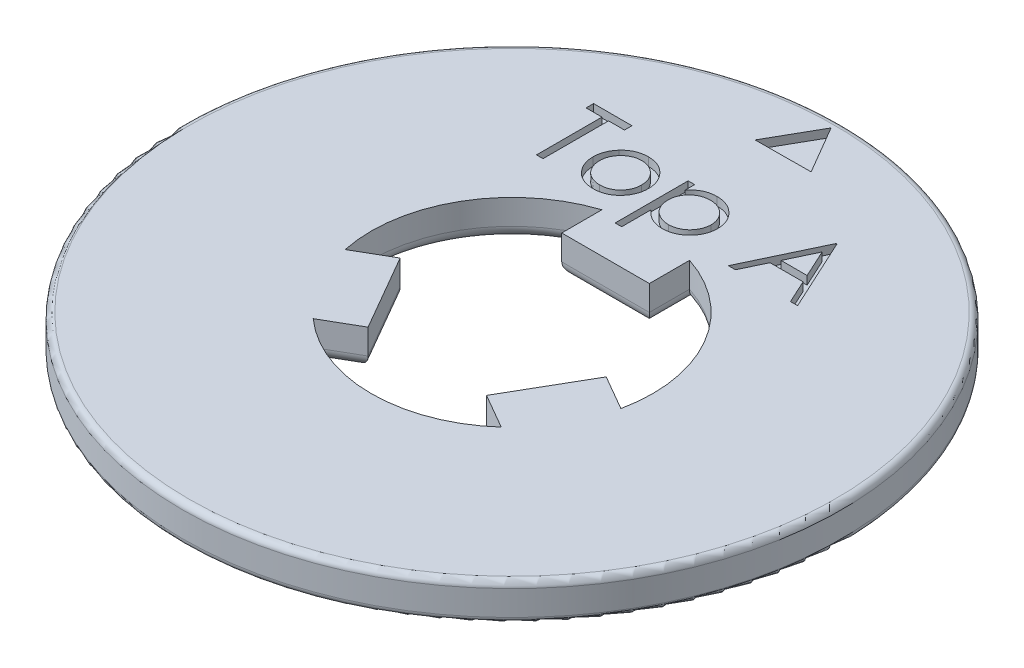
from build123d import *

# Parameters (mm, degrees)
SKETCH1_R           = 15.8
BOSS_EXTRUDE1_DEPTH = 1.8
FILLET1_R           = 0.3
FILLET3_R           = 0.6
CUT_EXTRUDE1_DEPTH  = 0.4
CUT_EXTRUDE2_DEPTH  = 0.4
SCALE1_SCALE        = 1.15


with BuildPart() as part:
    # Sketch1 → Boss-Extrude1 (new body)
    with BuildSketch(Plane(origin=(0, 0, 0), x_dir=(1, 0, 0), z_dir=(0, 1, 0))):
        with Locations(Location((0, 0, 0), (0, 0, 270))):
            Circle(SKETCH1_R)
        with BuildLine():
            Line((6.606243368, -1.385658169), (4.938104305, -0.422557631))
            Line((4.938104305, -0.422557631), (2.838104305, -4.059864327))
            Line((2.838104305, -4.059864327), (4.508004754, -5.023981801))
            ThreePointArc((4.508004754, -5.023981801), (0.003268724, -6.749999209), (-4.503136859, -5.028345496))
            Line((-4.503136859, -5.028345496), (-2.834997796, -4.065244959))
            Line((-2.834997796, -4.065244959), (-4.934997796, -0.427938263))
            Line((-4.934997796, -0.427938263), (-6.604898245, -1.392055737))
            ThreePointArc((-6.604898245, -1.392055737), (-5.847305152, 3.372168806), (-2.103106509, 6.414003665))
            Line((-2.103106509, 6.414003665), (-2.103106509, 4.48780259))
            Line((-2.103106509, 4.48780259), (2.096893491, 4.48780259))
            Line((2.096893491, 4.48780259), (2.096893491, 6.416037538))
            ThreePointArc((2.096893491, 6.416037538), (5.844036428, 3.377830402), (6.606243368, -1.385658169))
        make_face(mode=Mode.SUBTRACT)
    extrude(amount=BOSS_EXTRUDE1_DEPTH)

    # Fillet1
    fillet1_edges = [part.edges().sort_by_distance(p)[0] for p in [
        (0, 0, -15.8),
        (0, 1.8, -15.8),
    ]]
    fillet(fillet1_edges, radius=FILLET1_R)

    # Fillet3
    fillet3_edges = [part.edges().sort_by_distance(p)[0] for p in [
        (-5.847305152, 0, -3.372168806),
        (-5.76994802, 0, 0.909997),
        (-3.884997796, 0, 2.246591611),
        (-3.669067327, 0, 4.546795227),
        (0.003268724, 0, 6.749999209),
        (3.673054529, 0, 4.541923064),
        (3.888104305, 0, 2.241210979),
        (5.772173836, 0, 0.9041079),
        (5.844036428, 0, -3.377830402),
        (2.096893491, 0, -5.451920064),
        (-0.003106509, 0, -4.48780259),
        (-2.103106509, 0, -5.450903127),
    ]]
    fillet(fillet3_edges, radius=FILLET3_R)

    # Sketch3 → Cut-Extrude1 (cut)
    with BuildSketch(Plane(origin=(0, 1.8, 0), x_dir=(1, 0, 0), z_dir=(0, 1, 0))):
        Polygon((-1.330846249, 12.985829825), (1.340017361, 13.001714657), (-0.009171112, 15.306807977), align=None)
    extrude(amount=-CUT_EXTRUDE1_DEPTH, mode=Mode.SUBTRACT)

    # Sketch4 → Cut-Extrude2 (cut)
    # profile 1 of 4: a face of its own
    with BuildSketch(Plane(origin=(0, 1.8, 0), x_dir=(1, 0, 0), z_dir=(0, 1, 0))):
        Polygon((-6.712466694, 10.264172794), (-6.712466694, 10.623147153), (-4.872723104, 10.623147153), (-4.872723104, 10.264172794), (-5.635543617, 10.264172794), (-5.635543617, 7.123147153), (-5.949646181, 7.123147153), (-5.949646181, 10.264172794), align=None)
    # profile 2 of 4: a face of its own
    with BuildSketch(Plane(origin=(0, 1.8, 0), x_dir=(1, 0, 0), z_dir=(0, 1, 0))):
        with BuildLine():
            add(Edge.make_bspline(
                [(-3.188628553, 9.725711255), (-3.14063728, 9.724689364), (-3.046538122, 9.722685685), (-2.908730236, 9.70127072), (-2.777185101, 9.668523355), (-2.651398908, 9.623251793), (-2.532982613, 9.562569843), (-2.420211369, 9.490160552), (-2.31339436, 9.404377958), (-2.249371331, 9.33801989), (-2.216873745, 9.304337057)],
                knots=[0, 0, 0, 0, 1.054011418, 2.066658804, 3.057071809, 4.030435133, 4.997543892, 5.974964718, 6.972108034, 8, 8, 8, 8], degree=3))
            add(Edge.make_bspline(
                [(-2.216873745, 9.304337057), (-2.188891791, 9.272123071), (-2.133469411, 9.208318529), (-2.062403692, 9.104862916), (-2.001182132, 8.997722815), (-1.952119171, 8.885475488), (-1.913434147, 8.769100817), (-1.885968451, 8.648198806), (-1.869631516, 8.523036459), (-1.867428549, 8.438032621), (-1.866312848, 8.394982089)],
                knots=[0, 0, 0, 0, 1.025258237, 2.030674902, 3.01204498, 3.988269485, 4.97094183, 5.956517959, 6.965070386, 8, 8, 8, 8], degree=3))
            add(Edge.make_bspline(
                [(-1.866312848, 8.394982089), (-1.867294185, 8.351682031), (-1.869233353, 8.266119098), (-1.88757697, 8.140099732), (-1.916108056, 8.017904909), (-1.956939894, 7.900046216), (-2.009298003, 7.786163388), (-2.07318869, 7.676753839), (-2.149060308, 7.571601706), (-2.235064304, 7.471599867), (-2.330116181, 7.379433652), (-2.433232329, 7.299105383), (-2.542386363, 7.230283859), (-2.659029716, 7.174847443), (-2.782097203, 7.131137743), (-2.911854271, 7.100437726), (-3.048099341, 7.081876042), (-3.141126563, 7.079492469), (-3.188628553, 7.078275358)],
                knots=[0, 0, 0, 0, 0.998656419, 1.973391657, 2.932242238, 3.890759089, 4.846373663, 5.82037756, 6.809684879, 7.83454468, 8.860553229, 9.859544525, 10.845671541, 11.83227036, 12.833544569, 13.85385346, 14.904124723, 16, 16, 16, 16], degree=3))
            add(Edge.make_bspline(
                [(-3.188628553, 7.078275358), (-3.236363272, 7.079496554), (-3.329854132, 7.081888329), (-3.466580114, 7.100365611), (-3.596569733, 7.131123594), (-3.719798331, 7.174991087), (-3.836943178, 7.23028563), (-3.946729675, 7.29889732), (-4.049929591, 7.379457475), (-4.145001575, 7.471593412), (-4.231000181, 7.571603369), (-4.306873189, 7.676753407), (-4.370763515, 7.786163501), (-4.423121719, 7.900046186), (-4.463953532, 8.017904917), (-4.492484624, 8.14009973), (-4.510828239, 8.266119098), (-4.512767408, 8.351682031), (-4.513748745, 8.394982089)],
                knots=[0, 0, 0, 0, 1.099876186, 2.154163076, 3.173186993, 4.173200201, 5.163417411, 6.152872554, 7.150605724, 8.17532212, 9.198891216, 10.186952605, 11.159729845, 12.11414092, 13.071450619, 14.029093627, 15.002601286, 16, 16, 16, 16], degree=3))
            add(Edge.make_bspline(
                [(-4.513748745, 8.394982089), (-4.512625435, 8.437798635), (-4.510401473, 8.522568037), (-4.494080964, 8.647495098), (-4.466722408, 8.768192487), (-4.427991011, 8.884117963), (-4.37847582, 8.995873399), (-4.318114532, 9.10327823), (-4.2463239, 9.20626603), (-4.191121948, 9.26998811), (-4.163187848, 9.302233691)],
                knots=[0, 0, 0, 0, 1.031353054, 2.041901799, 3.029428768, 4.008703097, 4.981709435, 5.96992636, 6.972712378, 8, 8, 8, 8], degree=3))
            add(Edge.make_bspline(
                [(-4.163187848, 9.302233691), (-4.130739257, 9.336208631), (-4.066923393, 9.403026327), (-3.959574665, 9.488558851), (-3.847080844, 9.562474925), (-3.727355918, 9.62195114), (-3.60167306, 9.668789658), (-3.469453817, 9.701355173), (-3.331178302, 9.722608528), (-3.236618681, 9.724666706), (-3.188628553, 9.725711255)],
                knots=[0, 0, 0, 0, 1.027980169, 2.021703884, 2.998553061, 3.971491411, 4.943284454, 5.930300938, 6.949603206, 8, 8, 8, 8], degree=3))
        make_face()
        with BuildLine():
            add(Edge.make_bspline(
                [(-3.190030796, 9.411608691), (-3.223968408, 9.4106441), (-3.290967536, 9.408739817), (-3.389587121, 9.394255912), (-3.484527275, 9.371308408), (-3.575968119, 9.338704352), (-3.663601292, 9.296605453), (-3.747510694, 9.244897093), (-3.827943134, 9.184264136), (-3.903325197, 9.114801465), (-3.972507509, 9.03892247), (-4.032985486, 8.958074111), (-4.084410592, 8.873567765), (-4.127250751, 8.785315554), (-4.159157939, 8.69242314), (-4.182330962, 8.595942509), (-4.196801202, 8.495677092), (-4.198687581, 8.427516074), (-4.199646181, 8.392878723)],
                knots=[0, 0, 0, 0, 1.021534396, 2.016698045, 2.994645724, 3.958388632, 4.93408049, 5.916473867, 6.921342795, 7.962252576, 8.998418191, 10.008913653, 10.997312074, 11.973003931, 12.956656626, 13.948281152, 14.957379055, 16, 16, 16, 16], degree=3))
            add(Edge.make_bspline(
                [(-4.199646181, 8.392878723), (-4.198039357, 8.348126696), (-4.194850113, 8.259302291), (-4.168914876, 8.128491168), (-4.125528597, 8.002909316), (-4.066941317, 7.88329293), (-3.993535098, 7.772620652), (-3.907048031, 7.673949167), (-3.808408331, 7.588763356), (-3.698791831, 7.51808251), (-3.580437513, 7.461922755), (-3.455181192, 7.422123779), (-3.324540498, 7.396252087), (-3.235259767, 7.393680612), (-3.190030796, 7.392377922)],
                knots=[0, 0, 0, 0, 1.016792936, 2.018143844, 3.017858371, 4.030088057, 5.03801393, 6.028138512, 7.003788237, 7.991172063, 8.984598303, 9.972568034, 10.972917682, 12, 12, 12, 12], degree=3))
            add(Edge.make_bspline(
                [(-3.190030796, 7.392377922), (-3.144804427, 7.393688202), (-3.055528831, 7.396274659), (-2.925069655, 7.421993479), (-2.800155683, 7.46209714), (-2.681924295, 7.518019349), (-2.572357692, 7.589031764), (-2.47300857, 7.673468141), (-2.387259959, 7.772881993), (-2.313926354, 7.883439522), (-2.254379612, 8.002723874), (-2.21119641, 8.128514346), (-2.185198824, 8.259296388), (-2.182017995, 8.348124719), (-2.180415412, 8.392878723)],
                knots=[0, 0, 0, 0, 1.02726834, 2.027799167, 3.010890988, 4.004497153, 4.992059811, 5.971914811, 6.958719428, 7.966827853, 8.981595046, 9.981490638, 10.983022906, 12, 12, 12, 12], degree=3))
            add(Edge.make_bspline(
                [(-2.180415412, 8.392878723), (-2.181373682, 8.427516281), (-2.183259411, 8.495677707), (-2.197734375, 8.59594016), (-2.220889915, 8.692431757), (-2.252861532, 8.78528376), (-2.295515546, 8.873796265), (-2.347932339, 8.957825992), (-2.408163364, 9.039202538), (-2.478180485, 9.114556178), (-2.553483863, 9.184291215), (-2.633948901, 9.244920604), (-2.71773388, 9.2963782), (-2.805112463, 9.33906444), (-2.89656503, 9.371011781), (-2.99137216, 9.394388412), (-3.089570969, 9.408678609), (-3.156330013, 9.41062575), (-3.190030796, 9.411608691)],
                knots=[0, 0, 0, 0, 1.042956736, 2.052379634, 3.044323526, 4.02829302, 5.004299113, 5.996692471, 7.007513377, 8.048758398, 9.090003419, 10.095195979, 11.07790575, 12.047570684, 13.018257071, 13.989683339, 14.985167495, 16, 16, 16, 16], degree=3))
        make_face(mode=Mode.SUBTRACT)
    # profile 3 of 4: a face of its own
    with BuildSketch(Plane(origin=(0, 1.8, 0), x_dir=(1, 0, 0), z_dir=(0, 1, 0))):
        with BuildLine():
            Line((-1.238107719, 9.680839461), (-0.924005155, 9.680839461))
            Line((-0.924005155, 9.680839461), (-0.924005155, 9.207582249))
            add(Edge.make_bspline(
                [(-0.924005155, 9.207582249), (-0.890647671, 9.250519983), (-0.825824077, 9.333960876), (-0.714099172, 9.441951004), (-0.596172363, 9.533026308), (-0.46900895, 9.604408841), (-0.33458526, 9.658229653), (-0.193452943, 9.698009103), (-0.044414178, 9.721450577), (0.057482275, 9.724272239), (0.10944837, 9.725711255)],
                knots=[0, 0, 0, 0, 1.0828784, 2.104357462, 3.088488658, 4.04616522, 5.001424249, 5.969181776, 6.964304535, 8, 8, 8, 8], degree=3))
            add(Edge.make_bspline(
                [(0.10944837, 9.725711255), (0.154839974, 9.724398077), (0.244558862, 9.721802509), (0.376622091, 9.704229455), (0.503797474, 9.674111762), (0.625365528, 9.630710847), (0.742628593, 9.577055377), (0.853850693, 9.509338342), (0.960764249, 9.430932151), (1.060680438, 9.3407), (1.153001806, 9.243071734), (1.232847987, 9.138049429), (1.301719891, 9.029086843), (1.357390187, 8.914494751), (1.400998535, 8.795175521), (1.432013212, 8.67064708), (1.450470856, 8.54137114), (1.452947308, 8.453468419), (1.454199973, 8.409004525)],
                knots=[0, 0, 0, 0, 1.041296284, 2.058176809, 3.050446431, 4.034000596, 5.01514041, 6.003636468, 7.015969324, 8.052561599, 9.08815499, 10.094063707, 11.074456064, 12.040834395, 13.011057502, 13.983766392, 14.980127149, 16, 16, 16, 16], degree=3))
            add(Edge.make_bspline(
                [(1.454199973, 8.409004525), (1.452974487, 8.363602216), (1.450557653, 8.274062312), (1.431812647, 8.142575214), (1.401855773, 8.016087841), (1.35879759, 7.894810577), (1.303156101, 7.778826926), (1.235451541, 7.66822053), (1.155565074, 7.563026826), (1.064263946, 7.464673926), (0.96521101, 7.374074613), (0.859333521, 7.294836544), (0.748274595, 7.228295169), (0.632602428, 7.172712209), (0.511326789, 7.130820025), (0.385013512, 7.100602224), (0.253731365, 7.081967729), (0.164430213, 7.079515586), (0.119264075, 7.078275358)],
                knots=[0, 0, 0, 0, 1.038740735, 2.04854663, 3.033179607, 4.009277356, 4.987731542, 5.972001279, 6.972200261, 8.005528982, 9.039189865, 10.040446548, 11.026516639, 11.997840187, 12.972163198, 13.956796175, 14.96660207, 16, 16, 16, 16], degree=3))
            add(Edge.make_bspline(
                [(0.119264075, 7.078275358), (0.068436504, 7.079570166), (-0.031962853, 7.082127791), (-0.178760523, 7.108047201), (-0.320037375, 7.146784136), (-0.4542282, 7.20348313), (-0.582396012, 7.275738646), (-0.703815818, 7.363848852), (-0.819132571, 7.467629476), (-0.888541328, 7.546361293), (-0.924005155, 7.586588659)],
                knots=[0, 0, 0, 0, 1.014726462, 2.004382257, 2.969841629, 3.936926163, 4.907207904, 5.903978561, 6.929055279, 8, 8, 8, 8], degree=3))
            Line((-0.924005155, 7.586588659), (-0.924005155, 6.180839461))
            Line((-0.924005155, 6.180839461), (-1.238107719, 6.180839461))
            Line((-1.238107719, 6.180839461), (-1.238107719, 9.680839461))
        make_face()
        with BuildLine():
            add(Edge.make_bspline(
                [(0.106643883, 9.411608691), (0.071064321, 9.410968433), (0.001017333, 9.40970793), (-0.101654886, 9.394733981), (-0.200550314, 9.37299624), (-0.294672265, 9.340084339), (-0.384922882, 9.299685526), (-0.470607046, 9.249203515), (-0.551664614, 9.189551509), (-0.627891644, 9.121872165), (-0.696754938, 9.047297477), (-0.757717866, 8.967709668), (-0.808925171, 8.883209528), (-0.851427191, 8.794584166), (-0.883770474, 8.701138881), (-0.906726194, 8.603405868), (-0.921156546, 8.501278156), (-0.923045484, 8.431722149), (-0.924005155, 8.396384332)],
                knots=[0, 0, 0, 0, 1.05670511, 2.080379991, 3.077984906, 4.06214886, 5.038337365, 6.01289324, 7.01187578, 8.025460281, 9.038092164, 10.024533457, 11.000252242, 11.969694649, 12.940728589, 13.933144304, 14.949937299, 16, 16, 16, 16], degree=3))
            add(Edge.make_bspline(
                [(-0.924005155, 8.396384332), (-0.922414299, 8.34999622), (-0.919297677, 8.259117979), (-0.893960309, 8.126333857), (-0.852725045, 8.000682201), (-0.794196332, 7.883221164), (-0.720248757, 7.775238329), (-0.631150601, 7.678547723), (-0.52770805, 7.593757132), (-0.411640858, 7.522335878), (-0.287218728, 7.464347811), (-0.157432816, 7.422833601), (-0.024067935, 7.397261373), (0.066100385, 7.394014554), (0.111551736, 7.392377922)],
                knots=[0, 0, 0, 0, 1.03728447, 2.032128127, 3.01272805, 3.987917167, 4.958271349, 5.931593992, 6.91984656, 7.941419022, 8.973179163, 9.983609215, 10.983593296, 12, 12, 12, 12], degree=3))
            add(Edge.make_bspline(
                [(0.111551736, 7.392377922), (0.156087504, 7.393934299), (0.244482997, 7.397023427), (0.374641118, 7.423761615), (0.501131757, 7.464606639), (0.621311929, 7.524166196), (0.734135417, 7.597156254), (0.83601697, 7.684716287), (0.925023884, 7.78620623), (1.000888239, 7.899214733), (1.062019724, 8.020390117), (1.107949964, 8.145771505), (1.134458537, 8.274916928), (1.138215326, 8.361914641), (1.140097409, 8.405498916)],
                knots=[0, 0, 0, 0, 1.00104056, 1.986885549, 2.97790532, 3.984399681, 4.995088187, 5.994304198, 6.996462723, 8.023150851, 9.048424203, 10.043036403, 11.019596776, 12, 12, 12, 12], degree=3))
            add(Edge.make_bspline(
                [(1.140097409, 8.405498916), (1.138642675, 8.449353905), (1.135744541, 8.536722208), (1.107197503, 8.665485111), (1.064297526, 8.791373088), (1.001738474, 8.910893637), (0.927537204, 9.02366772), (0.837790207, 9.123221599), (0.737174011, 9.210392272), (0.624484847, 9.282407681), (0.503544421, 9.339693176), (0.376229506, 9.381576815), (0.243185903, 9.406750565), (0.152558249, 9.409975071), (0.106643883, 9.411608691)],
                knots=[0, 0, 0, 0, 0.983928682, 1.960191568, 2.949917689, 3.96440592, 4.982380491, 5.975291189, 6.965713506, 7.964880129, 8.970154049, 9.96478489, 10.968906225, 12, 12, 12, 12], degree=3))
        make_face(mode=Mode.SUBTRACT)
    # profile 4 of 4: a face of its own
    with BuildSketch(Plane(origin=(0, 1.8, 0), x_dir=(1, 0, 0), z_dir=(0, 1, 0))):
        Polygon((4.954199973, 10.623147153), (6.569584588, 7.123147153), (6.228138274, 7.123147153), (5.71071039, 8.244942025), (4.124071768, 8.244942025), (3.591920325, 7.123147153), (3.249071768, 7.123147153), (4.909328178, 10.623147153), align=None)
        Polygon((4.928258466, 9.940955646), (4.294444364, 8.603916384), (5.545245646, 8.603916384), align=None, mode=Mode.SUBTRACT)
    extrude(amount=-CUT_EXTRUDE2_DEPTH, mode=Mode.SUBTRACT)


with BuildPart() as part_1:
    # Scale1: scaled about (0.001439166, 0.899726286, 0.042311844)
    add(part.part.scale(SCALE1_SCALE).moved(Location((-0.000215875, -0.134958943, -0.006346777))))


solid = part_1.part
